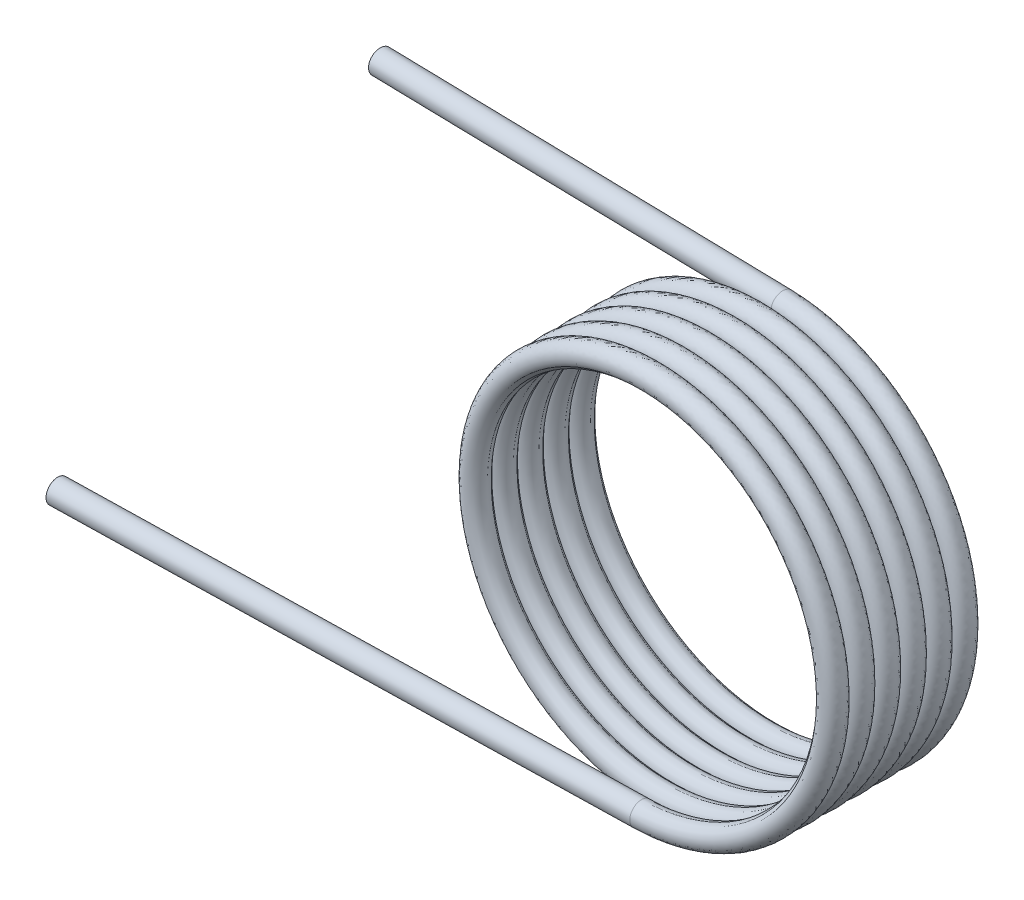
from build123d import *

# Parameters (mm, degrees)
SWEEP1_PITCH        = 3.229090909
SWEEP1_HEIGHT       = 17.76
SWEEP1_RADIUS       = 23.19
SWEEP1_START_ANGLE  = 90
SKETCH2_R           = 1.46
SKETCH3_R           = 1.46
BOSS_EXTRUDE1_DEPTH = 101.6
SKETCH4_R           = 1.46
BOSS_EXTRUDE2_DEPTH = 101.6
SKETCH5_R           = 5.71457576
CUT_EXTRUDE1_DEPTH  = 50
SKETCH6_R           = 6.6278677
CUT_EXTRUDE2_DEPTH  = 30


with BuildPart() as part:
    # Sweep1: sweep along a helix
    with BuildLine() as sweep1_path:
        add(Helix(SWEEP1_PITCH, SWEEP1_HEIGHT, SWEEP1_RADIUS, center=(0, 0, 0), direction=(0, 0, 1), lefthand=True, mode=Mode.PRIVATE).rotate(Axis((0, 0, 0), (0, 0, 1)), SWEEP1_START_ANGLE))
    # Sketch2 → Sweep1 (sweep)
    with BuildSketch(Plane(origin=(0, -23.19, 17.76), x_dir=(0.02215608552528747, -2.9385448225596144e-15, 0.9997545238078176), z_dir=(-0.9997545238078176, 7.623711740936303e-14, 0.02215608552528747))):
        Circle(SKETCH2_R)
    sweep(path=sweep1_path.line, is_frenet=True)

    # Sketch3 → Boss-Extrude1 (add)
    with BuildSketch(Plane(origin=(0, 0, 0), x_dir=(-0.022156085525287472, 0, 0.9997545238078176), z_dir=(-0.9997545238078176, -4.108120132853917e-15, -0.022156085525287472))):
        with Locations((0, 23.19)):
            Circle(SKETCH3_R)
    extrude(amount=BOSS_EXTRUDE1_DEPTH)

    # Sketch4 → Boss-Extrude2 (add)
    with BuildSketch(Plane(origin=(-0.393395486, 0, 0.008718244), x_dir=(0.02215608552528747, 7.59605993468812e-15, 0.9997545238078176), z_dir=(-0.9997545238078176, -4.242601007962503e-15, 0.02215608552528747))):
        with Locations((17.755640343, -23.19)):
            Circle(SKETCH4_R)
    extrude(amount=BOSS_EXTRUDE2_DEPTH)

    # Sketch5 → Cut-Extrude1 (cut)
    with BuildSketch(Plane(origin=(-101.575059619, 0, -2.251058289), x_dir=(-0.022156085525287476, 0, 0.9997545238078176), z_dir=(-0.9997545238078177, -4.108120132853917e-15, -0.022156085525287476))):
        with Locations((0, 23.19)):
            Circle(SKETCH5_R)
    extrude(amount=-CUT_EXTRUDE1_DEPTH, mode=Mode.SUBTRACT)

    # Sketch6 → Cut-Extrude2 (cut)
    with BuildSketch(Plane(origin=(-101.968455105, 0, 2.259776534), x_dir=(0.022156085525287472, 0, 0.9997545238078176), z_dir=(-0.9997545238078177, -4.242601007962503e-15, 0.022156085525287472))):
        with Locations((17.755640343, -23.19)):
            Circle(SKETCH6_R)
    extrude(amount=-CUT_EXTRUDE2_DEPTH, mode=Mode.SUBTRACT)


solid = part.part
